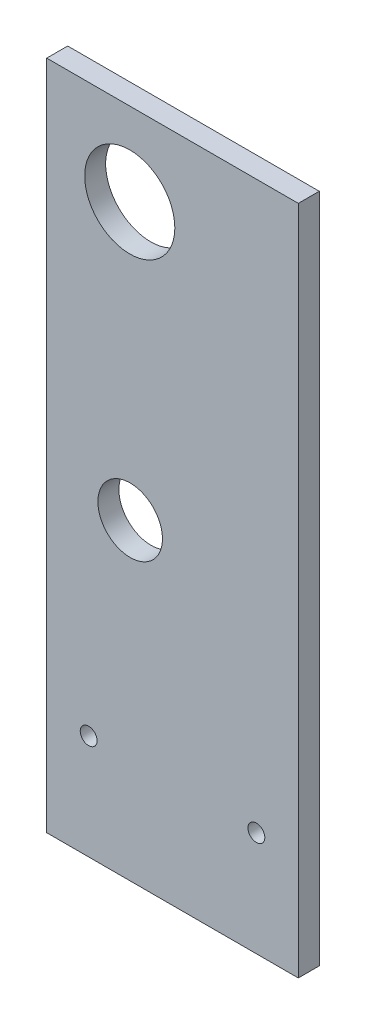
from build123d import *

# Parameters (mm, degrees)
SKETCH1_W           = 76.2
SKETCH1_H           = 203.2
BOSS_EXTRUDE1_DEPTH = 6.35
SKETCH2_R           = 9.779
SKETCH2_R_2         = 2.5527
CUT_EXTRUDE1_DEPTH  = 6.35
CUT_EXTRUDE3_DEPTH  = 6.35


with BuildPart() as part:
    # Sketch1 → Boss-Extrude1 (new body)
    with BuildSketch(Plane.XY):
        with Locations((-24.805306972, -63.605723205)):
            Rectangle(SKETCH1_W, SKETCH1_H)
    extrude(amount=BOSS_EXTRUDE1_DEPTH)

    # Sketch2 → Cut-Extrude1 (cut)
    with BuildSketch(Plane.XY.offset(6.35)):
        with Locations((-37.632306972, -70.590723205)):
            Circle(SKETCH2_R)
        with Locations((-50.205306972, -133.455723205)):
            Circle(SKETCH2_R_2)
        with Locations((0.594693028, -133.455723205)):
            Circle(SKETCH2_R_2)
    extrude(amount=-CUT_EXTRUDE1_DEPTH, mode=Mode.SUBTRACT)

    # Sketch7 → Cut-Extrude3 (cut)
    with BuildSketch(Plane.XY.offset(6.35)):
        with BuildLine():
            Line((-37.759306972, 25.294276795), (-37.759306972, 0.402276795))
            Line((-37.759306972, 0.402276795), (-32.147904273, 0.402276795))
            ThreePointArc((-32.147904273, 0.402276795), (-28.105531642, 3.194501465), (-25.313306972, 7.236874096))
            Line((-25.313306972, 7.236874096), (-25.313306972, 18.459679494))
            ThreePointArc((-25.313306972, 18.459679494), (-28.105531642, 22.502052125), (-32.147904273, 25.294276795))
            Line((-32.147904273, 25.294276795), (-37.759306972, 25.294276795))
        make_face()
        with BuildLine():
            Line((-25.313306972, 18.459679494), (-25.313306972, 7.236874096))
            ThreePointArc((-25.313306972, 7.236874096), (-24.411839586, 9.978456134), (-24.106806972, 12.848276795))
            ThreePointArc((-24.106806972, 12.848276795), (-24.411839586, 15.718097456), (-25.313306972, 18.459679494))
        make_face()
        with BuildLine():
            Line((-43.370709671, 25.294276795), (-37.759306972, 25.294276795))
            Line((-37.759306972, 25.294276795), (-32.147904273, 25.294276795))
            ThreePointArc((-32.147904273, 25.294276795), (-37.759306972, 26.500776795), (-43.370709671, 25.294276795))
        make_face()
        with BuildLine():
            Line((-32.147904273, 0.402276795), (-37.759306972, 0.402276795))
            Line((-37.759306972, 0.402276795), (-43.370709671, 0.402276795))
            ThreePointArc((-43.370709671, 0.402276795), (-37.759306972, -0.804223205), (-32.147904273, 0.402276795))
        make_face()
        with BuildLine():
            Line((-43.370709671, 0.402276795), (-37.759306972, 0.402276795))
            Line((-37.759306972, 0.402276795), (-37.759306972, 25.294276795))
            Line((-37.759306972, 25.294276795), (-43.370709671, 25.294276795))
            ThreePointArc((-43.370709671, 25.294276795), (-47.413082302, 22.502052125), (-50.205306972, 18.459679494))
            Line((-50.205306972, 18.459679494), (-50.205306972, 7.236874096))
            ThreePointArc((-50.205306972, 7.236874096), (-47.413082302, 3.194501465), (-43.370709671, 0.402276795))
        make_face()
        with BuildLine():
            ThreePointArc((-50.205306972, 18.459679494), (-51.411806972, 12.848276795), (-50.205306972, 7.236874096))
            Line((-50.205306972, 7.236874096), (-50.205306972, 18.459679494))
        make_face()
    extrude(amount=-CUT_EXTRUDE3_DEPTH, mode=Mode.SUBTRACT)


solid = part.part
